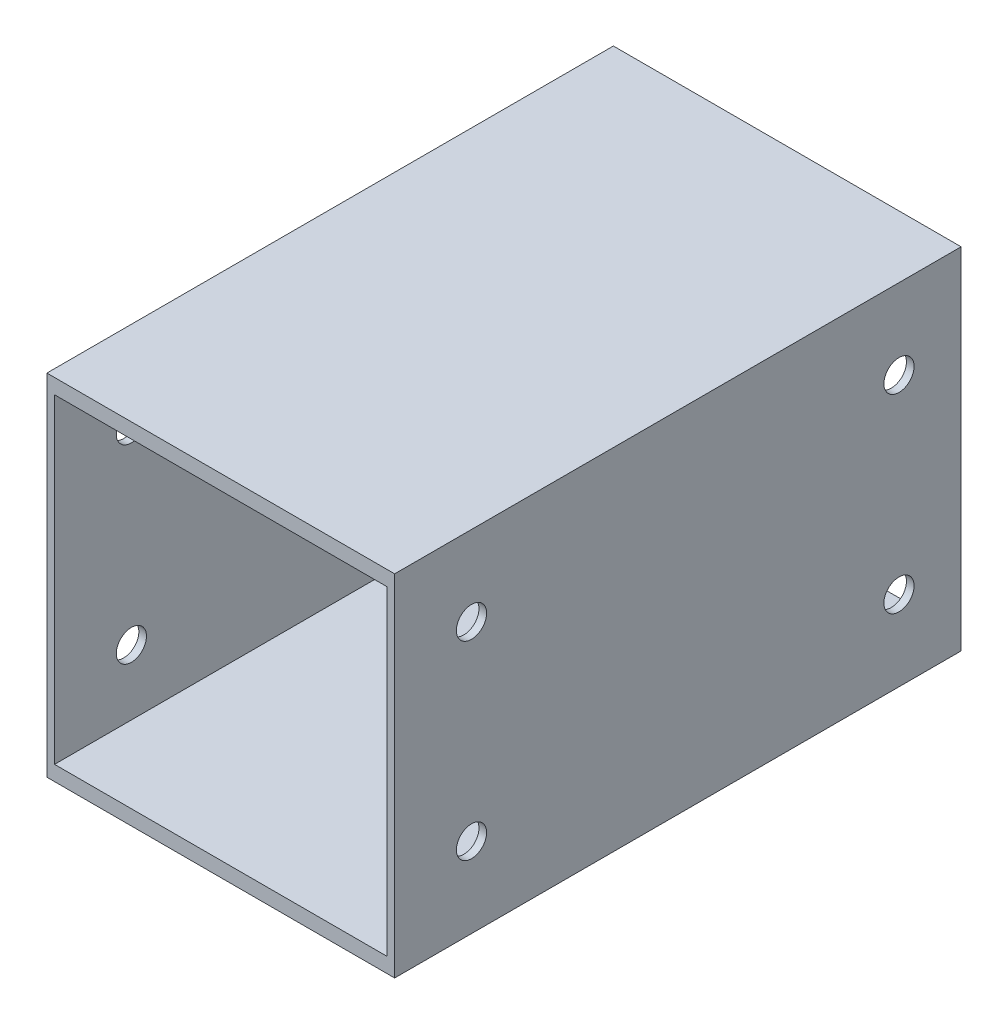
from build123d import *

# Parameters (mm, degrees)
CROQUIS1_W              = 46.491525
CROQUIS1_H              = 46.794250074
CROQUIS1_W_2            = 44.45
CROQUIS1_H_2            = 42.793750074
SALIENTE_EXTRUIR1_DEPTH = 75.731700962
CROQUIS2_R              = 2.0193
CORTAR_EXTRUIR1_DEPTH   = 92.89220798


with BuildPart() as part:
    # Croquis1 → Saliente-Extruir1 (new body)
    with BuildSketch(Plane.XY):
        Rectangle(CROQUIS1_W, CROQUIS1_H)
        Rectangle(CROQUIS1_W_2, CROQUIS1_H_2, mode=Mode.SUBTRACT)
    extrude(amount=SALIENTE_EXTRUIR1_DEPTH)

    # Croquis2 → Cortar-Extruir1 (cut, through all)
    with BuildSketch(Plane(origin=(-23.2457625, 0, 0), x_dir=(0, 1, 0), z_dir=(-1, 0, 0))):
        with Locations(Location((12.699999873, -65.456700938, 0), (0, 0, 270))):
            Circle(CROQUIS2_R)
        with Locations(Location((-12.699999873, -65.456700938, 0), (0, 0, 270))):
            Circle(CROQUIS2_R)
        with Locations(Location((-12.699999873, -8.306700938, 0), (0, 0, 270))):
            Circle(CROQUIS2_R)
        with Locations(Location((12.699999873, -8.306700938, 0), (0, 0, 270))):
            Circle(CROQUIS2_R)
    extrude(amount=-CORTAR_EXTRUIR1_DEPTH, mode=Mode.SUBTRACT)


solid = part.part
